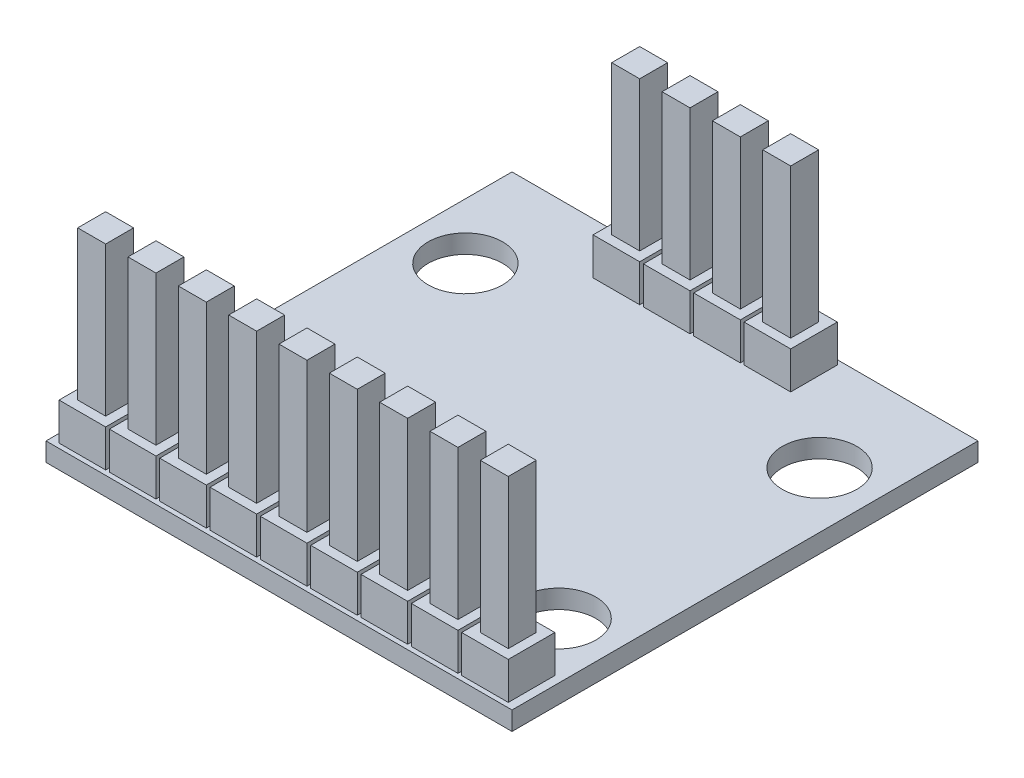
from build123d import *

# Parameters (mm, degrees)
SKETCH_1_W      = 25
SKETCH_1_H      = 25
SKETCH_1_R      = 2
SKETCH_1_W_2    = 2.5
SKETCH_1_H_2    = 2.5
EXTRUDE_1_DEPTH = 1
SKETCH_1_4_W    = 2.5
SKETCH_1_4_H    = 2.5
EXTRUDE_3_DEPTH = 3
SKETCH_3_W      = 1.5
SKETCH_3_H      = 1.5
EXTRUDE_4_DEPTH = 8


with BuildPart() as part:
    # Эскиз1 → Бобышка-Вытянуть1 (new body)
    with BuildSketch(Plane(origin=(0, 0, 0), x_dir=(1, 0, 0), z_dir=(0, 1, 0))):
        Rectangle(SKETCH_1_W, SKETCH_1_H)
        with Locations((-9.5, 7)):
            Circle(SKETCH_1_R, mode=Mode.SUBTRACT)
        with Locations((9.5, 7)):
            Circle(SKETCH_1_R, mode=Mode.SUBTRACT)
        with Locations((9.5, -7)):
            Circle(SKETCH_1_R, mode=Mode.SUBTRACT)
        with Locations((-9.5, -7)):
            Circle(SKETCH_1_R, mode=Mode.SUBTRACT)
        with Locations((2.7, -11)):
            Rectangle(SKETCH_1_W_2, SKETCH_1_H_2, mode=Mode.SUBTRACT)
        with Locations((0, -11)):
            Rectangle(SKETCH_1_W_2, SKETCH_1_H_2, mode=Mode.SUBTRACT)
        with Locations((-2.7, -11)):
            Rectangle(SKETCH_1_W_2, SKETCH_1_H_2, mode=Mode.SUBTRACT)
        with Locations((-5.4, -11)):
            Rectangle(SKETCH_1_W_2, SKETCH_1_H_2, mode=Mode.SUBTRACT)
        with Locations((-8.1, -11)):
            Rectangle(SKETCH_1_W_2, SKETCH_1_H_2, mode=Mode.SUBTRACT)
        with Locations((-10.8, -11)):
            Rectangle(SKETCH_1_W_2, SKETCH_1_H_2, mode=Mode.SUBTRACT)
        with Locations((1.25, 11)):
            Rectangle(SKETCH_1_W_2, SKETCH_1_H_2, mode=Mode.SUBTRACT)
        with Locations((-1.45, 11)):
            Rectangle(SKETCH_1_W_2, SKETCH_1_H_2, mode=Mode.SUBTRACT)
        with Locations((3.95, 11)):
            Rectangle(SKETCH_1_W_2, SKETCH_1_H_2, mode=Mode.SUBTRACT)
        with Locations((-4.15, 11)):
            Rectangle(SKETCH_1_W_2, SKETCH_1_H_2, mode=Mode.SUBTRACT)
        with Locations((5.4, -11)):
            Rectangle(SKETCH_1_W_2, SKETCH_1_H_2, mode=Mode.SUBTRACT)
        with Locations((8.1, -11)):
            Rectangle(SKETCH_1_W_2, SKETCH_1_H_2, mode=Mode.SUBTRACT)
        with Locations((10.8, -11)):
            Rectangle(SKETCH_1_W_2, SKETCH_1_H_2, mode=Mode.SUBTRACT)
    extrude(amount=EXTRUDE_1_DEPTH)

    # Эскиз1<4> → Бобышка-Вытянуть3 (add)
    with BuildSketch(Plane(origin=(0, 0, 0), x_dir=(1, 0, 0), z_dir=(0, 1, 0))):
        with Locations((2.7, -11)):
            Rectangle(SKETCH_1_4_W, SKETCH_1_4_H)
        with Locations((0, -11)):
            Rectangle(SKETCH_1_4_W, SKETCH_1_4_H)
        with Locations((-2.7, -11)):
            Rectangle(SKETCH_1_4_W, SKETCH_1_4_H)
        with Locations((-5.4, -11)):
            Rectangle(SKETCH_1_4_W, SKETCH_1_4_H)
        with Locations((-8.1, -11)):
            Rectangle(SKETCH_1_4_W, SKETCH_1_4_H)
        with Locations((-10.8, -11)):
            Rectangle(SKETCH_1_4_W, SKETCH_1_4_H)
        with Locations((1.25, 11)):
            Rectangle(SKETCH_1_4_W, SKETCH_1_4_H)
        with Locations((-1.45, 11)):
            Rectangle(SKETCH_1_4_W, SKETCH_1_4_H)
        with Locations((3.95, 11)):
            Rectangle(SKETCH_1_4_W, SKETCH_1_4_H)
        with Locations((-4.15, 11)):
            Rectangle(SKETCH_1_4_W, SKETCH_1_4_H)
        with Locations((5.4, -11)):
            Rectangle(SKETCH_1_4_W, SKETCH_1_4_H)
        with Locations((8.1, -11)):
            Rectangle(SKETCH_1_4_W, SKETCH_1_4_H)
        with Locations((10.8, -11)):
            Rectangle(SKETCH_1_4_W, SKETCH_1_4_H)
    extrude(amount=EXTRUDE_3_DEPTH)

    # Эскиз3 → Бобышка-Вытянуть4 (add)
    with BuildSketch(Plane(origin=(0, 3, 0), x_dir=(1, 0, 0), z_dir=(0, 1, 0))):
        with Locations((-4.15, 11)):
            Rectangle(SKETCH_3_W, SKETCH_3_H)
        with Locations((-1.45, 11)):
            Rectangle(SKETCH_3_W, SKETCH_3_H)
        with Locations((1.25, 11)):
            Rectangle(SKETCH_3_W, SKETCH_3_H)
        with Locations((3.95, 11)):
            Rectangle(SKETCH_3_W, SKETCH_3_H)
        with Locations((-8.1, -11)):
            Rectangle(SKETCH_3_W, SKETCH_3_H)
        with Locations((-10.8, -11)):
            Rectangle(SKETCH_3_W, SKETCH_3_H)
        with Locations((-5.4, -11)):
            Rectangle(SKETCH_3_W, SKETCH_3_H)
        with Locations((-2.7, -11)):
            Rectangle(SKETCH_3_W, SKETCH_3_H)
        with Locations((0, -11)):
            Rectangle(SKETCH_3_W, SKETCH_3_H)
        with Locations((2.7, -11)):
            Rectangle(SKETCH_3_W, SKETCH_3_H)
        with Locations((5.4, -11)):
            Rectangle(SKETCH_3_W, SKETCH_3_H)
        with Locations((8.1, -11)):
            Rectangle(SKETCH_3_W, SKETCH_3_H)
        with Locations((10.8, -11)):
            Rectangle(SKETCH_3_W, SKETCH_3_H)
    extrude(amount=EXTRUDE_4_DEPTH)


solid = part.part
